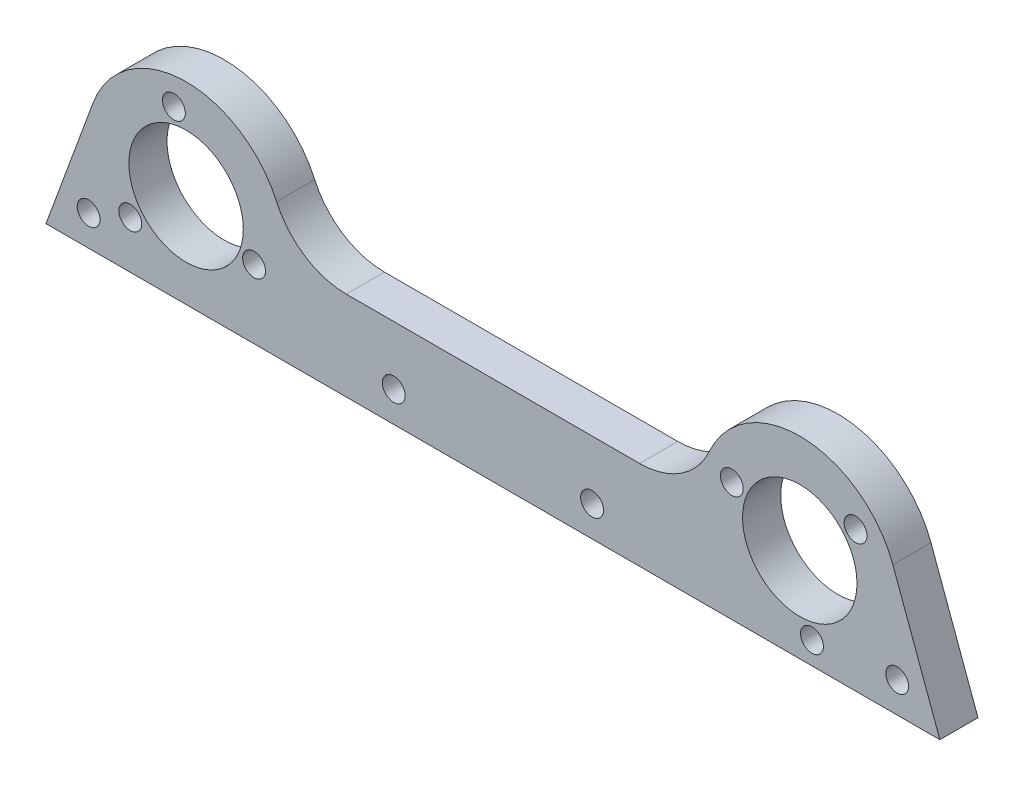
from build123d import *

# Parameters (mm, degrees)
EXTRUDE_START          = 1.25
EXTRUDE_1_DEPTH        = 2.5
SKETCH_2_R             = 7.5
CUT_EXTRUDE_1_DEPTH    = 32.659095027
PATTERN_LINEAR_1_COUNT = 2
PATTERN_LINEAR_1_PITCH = 80.45
SKETCH_3_W             = 52.302227504
SKETCH_3_H             = 11.68512329
EXTRUDE_2_DEPTH        = 5
FILLET_1_R             = 10
SKETCH_4_R             = 1.5
CUT_EXTRUDE_2_DEPTH    = 103.123184877
SKETCH_5_R             = 1.5
CUT_EXTRUDE_3_DEPTH    = 103.123184877


with BuildPart() as part:
    # 草图1 → 凸台-拉伸1 (new, symmetric)
    with BuildSketch(Plane.XY.offset(EXTRUDE_START)):
        with BuildLine():
            Line((-18.36323223, 0), (18.36323223, 0))
            Line((18.36323223, 0), (12.203770764, 16.779729806))
            ThreePointArc((12.203770764, 16.779729806), (0, 25.3), (-12.203770764, 16.779729806))
            Line((-12.203770764, 16.779729806), (-18.36323223, 0))
        make_face()
    extrude(amount=EXTRUDE_1_DEPTH, both=True)

    # 草图2 → 切除-拉伸1 (cut, through all)
    with BuildSketch(Plane.XY.offset(3.75)):
        with Locations((0, 12.3)):
            Circle(SKETCH_2_R)
    extrude(amount=-CUT_EXTRUDE_1_DEPTH, mode=Mode.SUBTRACT)


with BuildPart() as pattern_linear_1_1:
    # 阵列(线性)1: pattern copy
    add(part.part.moved(Location(Vector(1, 0, 0) * (1 * PATTERN_LINEAR_1_PITCH))))


with BuildPart() as part_1:
    add(part.part)

    add(pattern_linear_1_1.part)  # 凸台-拉伸2 merges 阵列(线性)1_1
    # 草图3 → 凸台-拉伸2 (add)
    with BuildSketch(Plane(origin=(0, 0, -1.25), x_dir=(-1, 0, 0), z_dir=(0, 0, -1))):
        with Locations((-40.225, 5.842561645)):
            Rectangle(SKETCH_3_W, SKETCH_3_H)
    extrude(amount=-EXTRUDE_2_DEPTH)

    # 圆角1
    fillet_1_edges = [part_1.edges().sort_by_distance(p)[0] for p in [
        (14.073886248, 11.68512329, 1.25),
        (66.376113752, 11.68512329, 1.25),
    ]]
    fillet(fillet_1_edges, radius=FILLET_1_R)

    # 草图4 → 切除-拉伸2 (cut, through all)
    with BuildSketch(Plane(origin=(0, 0, -1.25), x_dir=(-1, 0, 0), z_dir=(0, 0, -1))):
        with Locations((1.598414444, 21.66456466)):
            Circle(SKETCH_4_R)
        with Locations((7.310743669, 6.233450156)):
            Circle(SKETCH_4_R)
        with Locations((-8.909158113, 9.001985185)):
            Circle(SKETCH_4_R)
        with Locations((-71.540841887, 15.598014815)):
            Circle(SKETCH_4_R)
        with Locations((-82.048414444, 2.93543534)):
            Circle(SKETCH_4_R)
        with Locations((-87.760743669, 18.366549844)):
            Circle(SKETCH_4_R)
    extrude(amount=-CUT_EXTRUDE_2_DEPTH, mode=Mode.SUBTRACT)

    # 草图5 → 切除-拉伸3 (cut, through all)
    with BuildSketch(Plane(origin=(0, 0, -1.25), x_dir=(-1, 0, 0), z_dir=(0, 0, -1))):
        with Locations((-93.225, 4)):
            Circle(SKETCH_5_R)
        with Locations((-53.225, 4)):
            Circle(SKETCH_5_R)
        with Locations(Location((12.775, 4, 0), (0, 0, 180))):
            Circle(SKETCH_5_R)
        with Locations(Location((-27.225, 4, 0), (0, 0, 180))):
            Circle(SKETCH_5_R)
    extrude(amount=-CUT_EXTRUDE_3_DEPTH, mode=Mode.SUBTRACT)


solid = part_1.part
